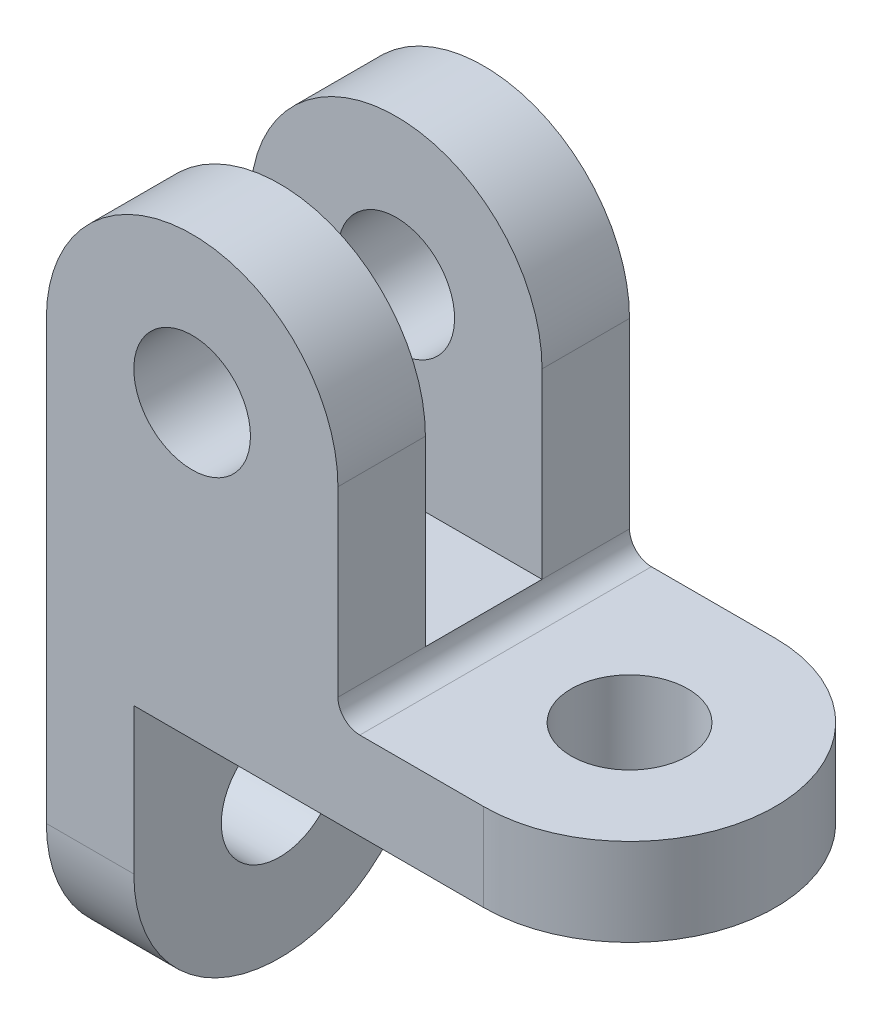
from build123d import *

# Parameters (mm, degrees)
BOSS_EXTRUDE3_DEPTH     = 40
CUT_EXTRUDE4_DEPTH      = 12
CUT_EXTRUDE5_DEPTH      = 22.5
CUT_EXTRUDE7_DEPTH      = 45
SKETCH13_R              = 8
CUT_EXTRUDE8_DEPTH      = 45
CUT_EXTRUDE9_DEPTH      = 54
CUT_EXTRUDE9_DEPTH_BACK = 41
SKETCH14_R              = 8


with BuildPart() as part:
    # Sketch1 → Boss-Extrude3 (new body)
    with BuildSketch(Plane.XY):
        with BuildLine():
            Line((23, 0), (60, 0))
            Line((60, 0), (60, -12))
            Line((60, -12), (-8, -12))
            Line((-8, -12), (-8, -52))
            Line((-8, -52), (-20, -52))
            Line((-20, -52), (-20, 28))
            ThreePointArc((-20, 28), (0, 48), (20, 28))
            Line((20, 28), (20, 3))
            ThreePointArc((20, 3), (20.878679656, 0.878679656), (23, 0))
        make_face()
    extrude(amount=BOSS_EXTRUDE3_DEPTH)

    # Sketch10 → Cut-Extrude4 (cut)
    with BuildSketch(Plane(origin=(0, 0, 0), x_dir=(1, 0, 0), z_dir=(0, 1, 0))):
        with BuildLine():
            Line((60, -40), (60, -20))
            ThreePointArc((60, -20), (54.142135624, -34.142135624), (40, -40))
            Line((40, -40), (60, -40))
        make_face()
        with BuildLine():
            Line((60, -20), (60, 0))
            Line((60, 0), (40, 0))
            ThreePointArc((40, 0), (54.142135624, -5.857864376), (60, -20))
        make_face()
    extrude(amount=-CUT_EXTRUDE4_DEPTH, mode=Mode.SUBTRACT)

    # Sketch11 → Cut-Extrude5 (cut, symmetric)
    with BuildSketch(Plane(origin=(0, 0, 0), x_dir=(0, 0, -1), z_dir=(1, 0, 0))):
        Polygon((-20, 48), (-28, 48), (-28, 3), (-12, 3), (-12, 48), align=None)
    extrude(amount=CUT_EXTRUDE5_DEPTH, both=True, mode=Mode.SUBTRACT)

    # Sketch12 → Cut-Extrude7 (cut)
    with BuildSketch(Plane(origin=(-8, 0, 0), x_dir=(0, 0, -1), z_dir=(1, 0, 0))):
        with BuildLine():
            ThreePointArc((-20, -24), (-28, -32), (-20, -40))
            Line((-20, -40), (-20, -24))
        make_face()
        with BuildLine():
            Line((-20, -24), (-20, -40))
            ThreePointArc((-20, -40), (-14.343145751, -37.656854249), (-12, -32))
            ThreePointArc((-12, -32), (-14.343145751, -26.343145751), (-20, -24))
        make_face()
        with BuildLine():
            Line((-40, -52), (-20, -52))
            ThreePointArc((-20, -52), (-34.142135624, -46.142135624), (-40, -32))
            Line((-40, -32), (-40, -52))
        make_face()
        with BuildLine():
            ThreePointArc((0, -32), (-5.857864376, -46.142135624), (-20, -52))
            Line((-20, -52), (0, -52))
            Line((0, -52), (0, -32))
        make_face()
    extrude(amount=-CUT_EXTRUDE7_DEPTH, mode=Mode.SUBTRACT)

    # Sketch13 → Cut-Extrude8 (cut)
    with BuildSketch(Plane(origin=(0, 0, 0), x_dir=(1, 0, 0), z_dir=(0, 1, 0))):
        with Locations(Location((40, -20, 0), (0, 0, 270))):
            Circle(SKETCH13_R)
    extrude(amount=-CUT_EXTRUDE8_DEPTH, mode=Mode.SUBTRACT)

    # Sketch14 → Cut-Extrude9 (cut, two sides: drawn at the far end of the back side and taken through both)
    with BuildSketch(Plane.XY.offset(-CUT_EXTRUDE9_DEPTH_BACK)):
        with Locations(Location((0, 28, 0), (0, 0, 270))):
            Circle(SKETCH14_R)
    extrude(amount=CUT_EXTRUDE9_DEPTH + CUT_EXTRUDE9_DEPTH_BACK, mode=Mode.SUBTRACT)


solid = part.part
